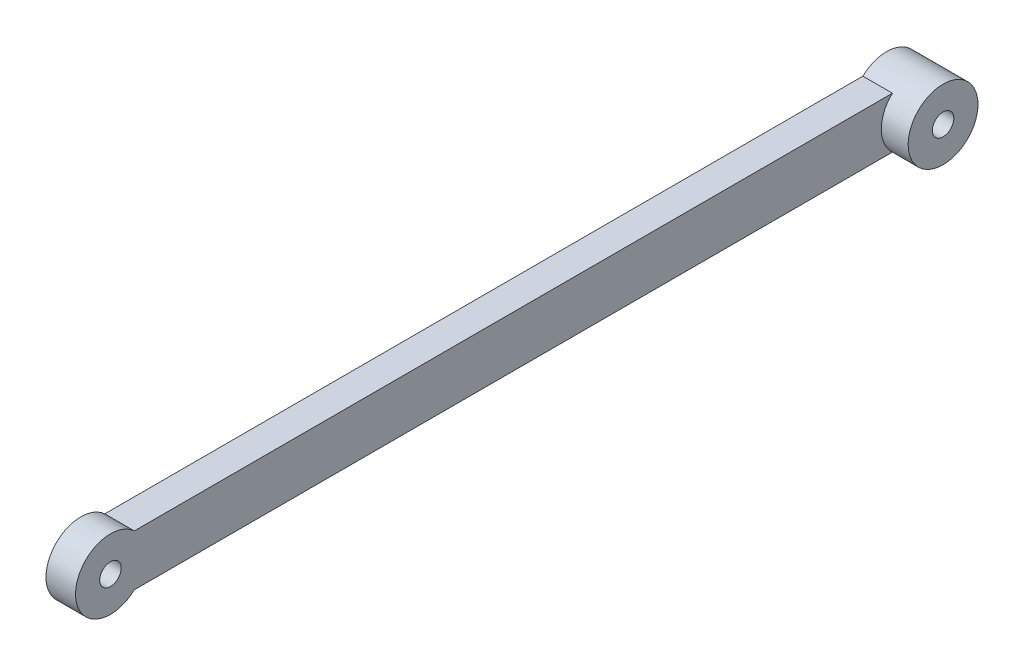
from build123d import *
from build123d.topology import SkipClean

# Parameters (mm, degrees)
SKETCH1_R           = 2
BOSS_EXTRUDE1_DEPTH = 5.5
SKETCH2_R           = 6.5
SKETCH2_R_2         = 2
BOSS_EXTRUDE3_DEPTH = 5


with BuildPart() as part:
    # Sketch1 → Boss-Extrude1 (new body)
    with BuildSketch(Plane(origin=(0, 0, 0), x_dir=(0, 0, -1), z_dir=(1, 0, 0))):
        with BuildLine():
            Line((4.437059837, 4.75), (145.562940163, 4.75))
            ThreePointArc((145.562940163, 4.75), (156.5, 0), (145.562940163, -4.75))
            Line((145.562940163, -4.75), (4.437059837, -4.75))
            ThreePointArc((4.437059837, -4.75), (-6.5, 0), (4.437059837, 4.75))
        make_face()
        Circle(SKETCH1_R, mode=Mode.SUBTRACT)
        with Locations((150, 0)):
            Circle(SKETCH1_R, mode=Mode.SUBTRACT)
    extrude(amount=BOSS_EXTRUDE1_DEPTH)

    # Sketch2 → Boss-Extrude3 (add)
    with SkipClean():  # the faces are left unmerged after this step: merging them gives an invalid solid
        with BuildSketch(Plane(origin=(5.5, 0, 0), x_dir=(0, 0, -1), z_dir=(1, 0, 0))):
            with Locations(Location((150, 0, 0), (0, 0, 226.9509202))):
                Circle(SKETCH2_R)
            with Locations((150, 0)):
                Circle(SKETCH2_R_2, mode=Mode.SUBTRACT)
        extrude(amount=BOSS_EXTRUDE3_DEPTH)


solid = part.part
